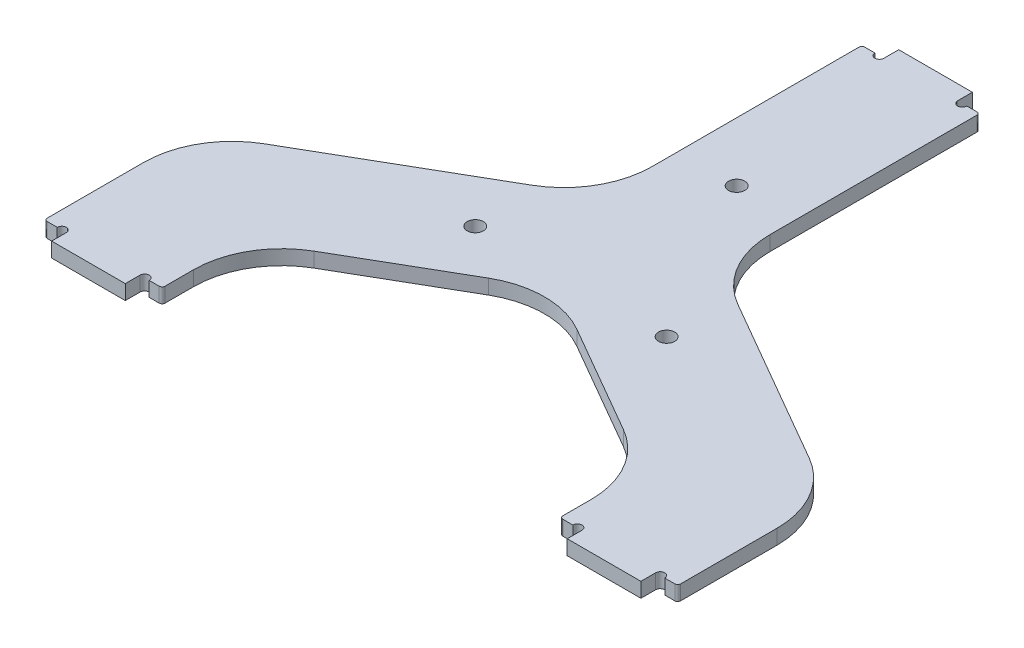
from build123d import *

# Parameters (mm, degrees)
EXTRUDE_1_DEPTH     = 5
SKETCH_3_R          = 2.75
CUT_EXTRUDE_1_DEPTH = 5
SKETCH_4_W          = 25
SKETCH_4_H          = 5
EXTRUDE_2_DEPTH     = 5
SKETCH_5_R          = 1.55
CUT_EXTRUDE_2_DEPTH = 5
FILLET_1_R          = 30
FILLET_2_R          = 1


with BuildPart() as part:
    # 草图1 → 凸台-拉伸1 (new body)
    with BuildSketch(Plane(origin=(0, 0, 0), x_dir=(1, 0, 0), z_dir=(0, 1, 0))):
        Polygon((-20, 100), (20, 100), (20, 11.547005384), (87.5, -27.424137787), (107.5, -38.97114317), (107.5, -90), (67.5, -90), (67.5, -62.065153938), (0, -23.094010768), (-67.5, -62.065153938), (-67.5, -90), (-107.5, -90), (-107.5, -38.97114317), (-87.5, -27.424137787), (-20, 11.547005384), align=None)
    extrude(amount=EXTRUDE_1_DEPTH)

    # 草图3 → 切除-拉伸1 (cut)
    with BuildSketch(Plane(origin=(0, 5, 0), x_dir=(1, 0, 0), z_dir=(0, 1, 0))):
        with Locations(Location((0, 37.498899984, 0), (0, 0, 270))):
            Circle(SKETCH_3_R)
        with Locations(Location((32.475, -18.749449992, 0), (0, 0, 270))):
            Circle(SKETCH_3_R)
        with Locations(Location((-32.475, -18.749449992, 0), (0, 0, 270))):
            Circle(SKETCH_3_R)
    extrude(amount=-CUT_EXTRUDE_1_DEPTH, mode=Mode.SUBTRACT)

    # 草图4 → 凸台-拉伸2 (add)
    with BuildSketch(Plane(origin=(0, 5, 0), x_dir=(1, 0, 0), z_dir=(0, 1, 0))):
        with Locations((-87.5, -92.5)):
            Rectangle(SKETCH_4_W, SKETCH_4_H)
        with Locations((87.5, -92.5)):
            Rectangle(SKETCH_4_W, SKETCH_4_H)
        with Locations((0, 102.5)):
            Rectangle(SKETCH_4_W, SKETCH_4_H)
    extrude(amount=-EXTRUDE_2_DEPTH)

    # 草图5 → 切除-拉伸2 (cut)
    with BuildSketch(Plane(origin=(0, 5, 0), x_dir=(1, 0, 0), z_dir=(0, 1, 0))):
        with Locations((14.05, 100)):
            Circle(SKETCH_5_R)
        with Locations((-14.05, 100)):
            Circle(SKETCH_5_R)
        with Locations((-73.45, -90)):
            Circle(SKETCH_5_R)
        with Locations((-101.55, -90)):
            Circle(SKETCH_5_R)
        with Locations((101.55, -90)):
            Circle(SKETCH_5_R)
        with Locations((73.45, -90)):
            Circle(SKETCH_5_R)
    extrude(amount=-CUT_EXTRUDE_2_DEPTH, mode=Mode.SUBTRACT)

    # 圆角1
    fillet_1_edges = [part.edges().sort_by_distance(p)[0] for p in [
        (-20, 2.5, -11.547005384),
        (20, 2.5, -11.547005384),
        (107.5, 2.5, 38.97114317),
        (67.5, 2.5, 62.065153938),
        (0, 2.5, 23.094010768),
        (-67.5, 2.5, 62.065153938),
        (-107.5, 2.5, 38.97114317),
    ]]
    fillet(fillet_1_edges, radius=FILLET_1_R)

    # 圆角2
    fillet_2_edges = [part.edges().sort_by_distance(p)[0] for p in [
        (-20, 2.5, -100),
        (20, 2.5, -100),
        (107.5, 2.5, 90),
        (67.5, 2.5, 90),
        (-67.5, 2.5, 90),
        (-107.5, 2.5, 90),
    ]]
    fillet(fillet_2_edges, radius=FILLET_2_R)


solid = part.part
